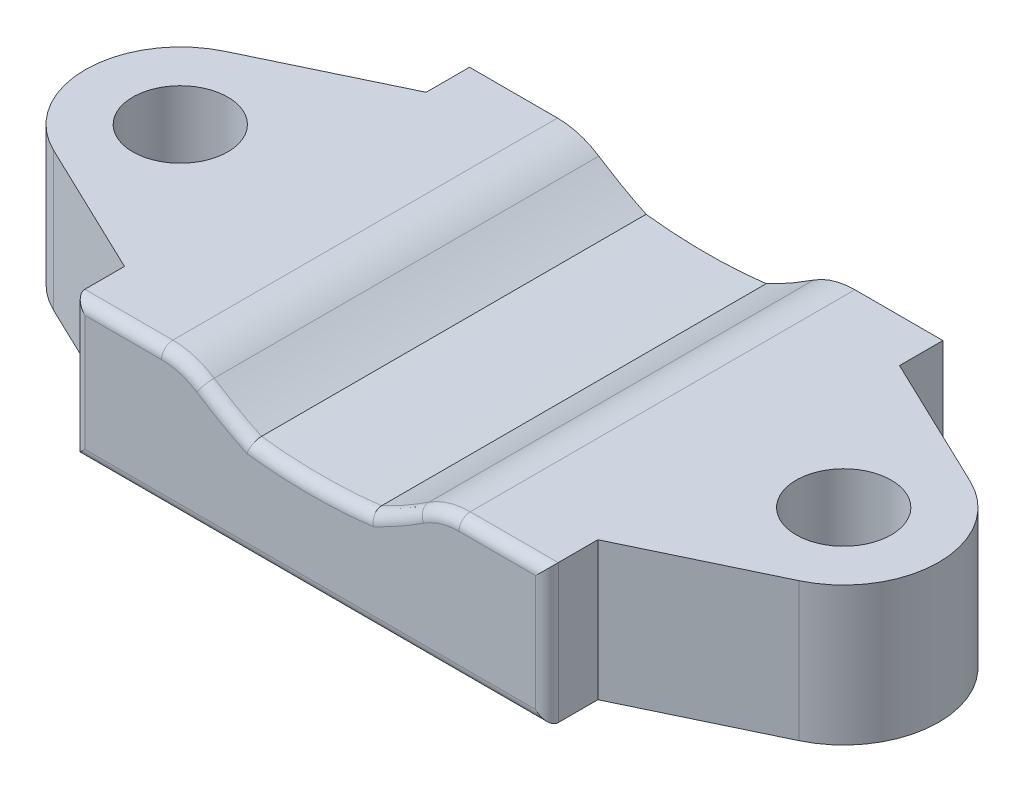
from build123d import *

# Parameters (mm, degrees)
SKETCH2_R           = 1.6002
BOSS_EXTRUDE1_DEPTH = 4.667499936
CUT_EXTRUDE1_DEPTH  = 21.154182295
FILLET4_R           = 0.381


with BuildPart() as part:
    # Sketch2 → Boss-Extrude1 (new body)
    with BuildSketch(Plane(origin=(0, 0, 0), x_dir=(1, 0, 0), z_dir=(0, 1, 0))):
        with BuildLine():
            Line((-7.972205369, 13.335), (-7.972205369, 11.8745))
            Line((-7.972205369, 11.8745), (-12.55435155, 9.681252094))
            ThreePointArc((-12.55435155, 9.681252094), (-14.373005369, 6.7945), (-12.55435155, 3.907747906))
            Line((-12.55435155, 3.907747906), (-7.972205369, 1.7145))
            Line((-7.972205369, 1.7145), (-7.972205369, 0))
            Line((-7.972205369, 0), (7.972205369, 0))
            Line((7.972205369, 0), (7.972205369, 1.7145))
            Line((7.972205369, 1.7145), (12.55435155, 3.907747906))
            ThreePointArc((12.55435155, 3.907747906), (14.373005369, 6.7945), (12.55435155, 9.681252094))
            Line((12.55435155, 9.681252094), (7.972205369, 11.8745))
            Line((7.972205369, 11.8745), (7.972205369, 13.335))
            Line((7.972205369, 13.335), (-7.972205369, 13.335))
        make_face()
        with Locations(Location((-11.172605369, 6.7945, 0), (0, 0, 270))):
            Circle(SKETCH2_R, mode=Mode.SUBTRACT)
        with Locations(Location((11.172605369, 6.7945, 0), (0, 0, 270))):
            Circle(SKETCH2_R, mode=Mode.SUBTRACT)
    extrude(amount=BOSS_EXTRUDE1_DEPTH)

    # Sketch1 → Cut-Extrude1 (cut, through all)
    with BuildSketch(Plane.XY):
        with BuildLine():
            Line((-2.413, 4.667499936), (-5.008252596, 4.667499936))
            ThreePointArc((-5.008252596, 4.667499936), (-4.93107218, 4.666327064), (-4.853963042, 4.662809529))
            ThreePointArc((-4.853963042, 4.662809529), (-4.208266886, 4.53823071), (-3.616192862, 4.25206335))
            add(Edge.make_bspline(
                [(-3.616192862, 4.25206335), (-3.387788659, 4.102407993), (-2.866953164, 3.782649369), (-2.327154274, 3.498343868), (-2.022863606, 3.35198033)],
                knots=[0.154249258, 0.154249258, 0.154249258, 0.154249258, 0.327774555, 0.542511986, 0.542511986, 0.542511986, 0.542511986], degree=3))
            ThreePointArc((-2.022863606, 3.35198033), (-2.313410781, 3.981424459), (-2.413, 4.667499936))
        make_face()
        with BuildLine():
            Line((0, 4.667499936), (-2.413, 4.667499936))
            ThreePointArc((-2.413, 4.667499936), (-2.313410781, 3.981424459), (-2.022863606, 3.35198033))
            Line((-2.022863606, 3.35198033), (0, 3.35198033))
            Line((0, 3.35198033), (0, 4.667499936))
        make_face()
        with BuildLine():
            Line((2.413, 4.667499936), (0, 4.667499936))
            Line((0, 4.667499936), (0, 3.35198033))
            Line((0, 3.35198033), (2.022863606, 3.35198033))
            ThreePointArc((2.022863606, 3.35198033), (2.313410781, 3.981424459), (2.413, 4.667499936))
        make_face()
        with BuildLine():
            Line((0, 3.35198033), (-2.022863606, 3.35198033))
            add(Edge.make_bspline(
                [(-2.022863606, 3.35198033), (-1.011431803, 3.228904982), (0, 3.228904982)],
                knots=[0, 0, 0, 0.5, 0.5, 0.5], degree=2))
            Line((0, 3.228904982), (0, 3.35198033))
        make_face()
        with BuildLine():
            Line((2.022863606, 3.35198033), (0, 3.35198033))
            Line((0, 3.35198033), (0, 3.228904982))
            add(Edge.make_bspline(
                [(0, 3.228904982), (1.011431803, 3.228904982), (2.022863606, 3.35198033)],
                knots=[0.5, 0.5, 0.5, 1, 1, 1], degree=2))
        make_face()
        with BuildLine():
            Line((5.008252596, 4.667499936), (2.413, 4.667499936))
            ThreePointArc((2.413, 4.667499936), (2.313410781, 3.981424459), (2.022863606, 3.35198033))
            add(Edge.make_bspline(
                [(3.616192862, 4.25206335), (3.387788659, 4.102407993), (2.866953164, 3.782649369), (2.327154274, 3.498343868), (2.022863606, 3.35198033)],
                knots=[0.154249258, 0.154249258, 0.154249258, 0.154249258, 0.327774555, 0.542511986, 0.542511986, 0.542511986, 0.542511986], degree=3))
            ThreePointArc((3.616192862, 4.25206335), (4.208266886, 4.53823071), (4.853963042, 4.662809529))
            ThreePointArc((4.853963042, 4.662809529), (4.93107218, 4.666327064), (5.008252596, 4.667499936))
        make_face()
    extrude(amount=-CUT_EXTRUDE1_DEPTH, mode=Mode.SUBTRACT)

    # Fillet4
    fillet4_edges = [part.edges().sort_by_distance(p)[0] for p in [
        (0, 0, 0),
        (-6.490228982, 4.667499936, 0),
        (7.972205369, 2.333749968, 0),
        (-7.972205369, 2.333749968, 0),
        (6.490228982, 4.667499936, 0),
        (4.28188873, 4.561425887, 0),
        (2.834354543, 3.775775499, 0),
        (-4.28188873, 4.561425887, 0),
        (-2.834354543, 3.775775499, 0),
        (1.013295224, 3.259787298, 0),
    ]]
    fillet(fillet4_edges, radius=FILLET4_R)


solid = part.part
